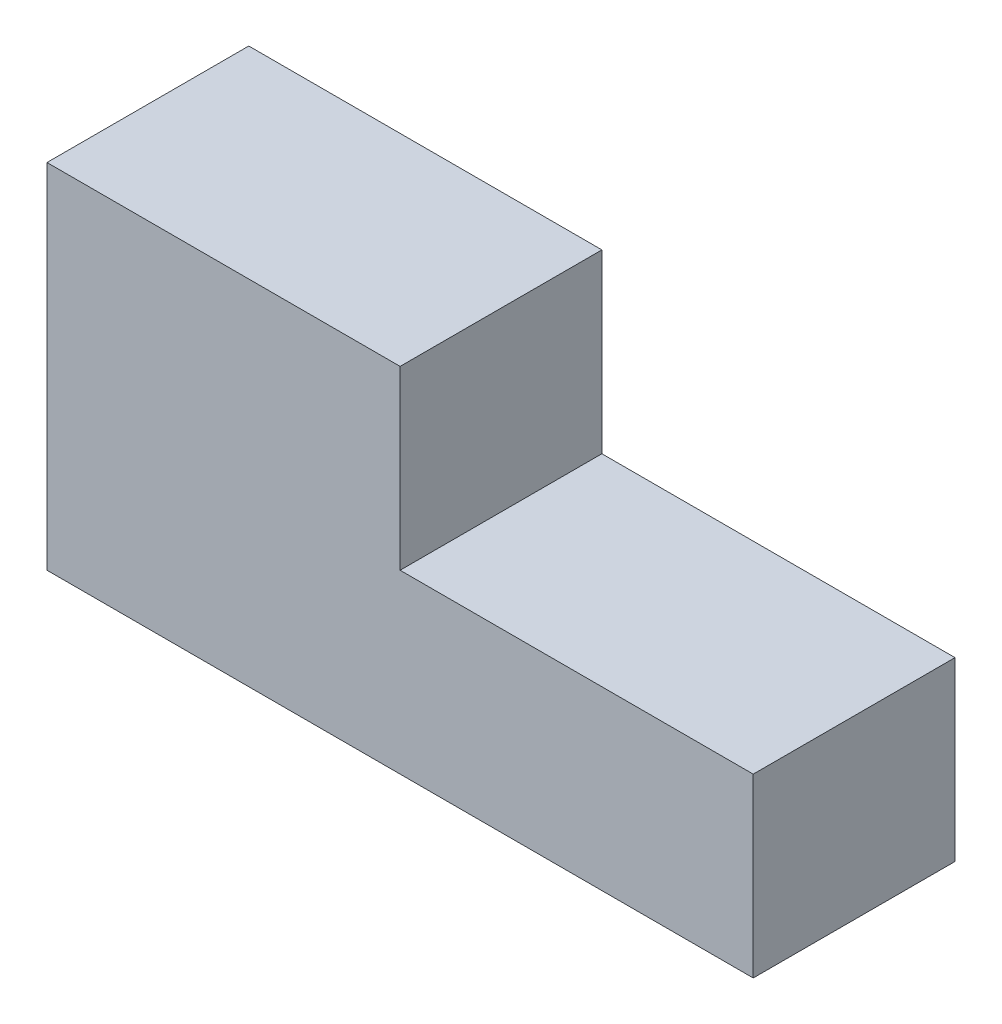
from build123d import *

# Parameters (mm, degrees)
BOSS_EXTRUDE1_DEPTH = 12.7


with BuildPart() as part:
    # Sketch2 → Boss-Extrude1 (new, symmetric)
    with BuildSketch(Plane.XY):
        Polygon((-45.993128667, 20.014327215), (-45.993128667, -24.435672785), (42.906871333, -24.435672785), (42.906871333, -2.210672785), (-1.543128667, -2.210672785), (-1.543128667, 20.014327215), align=None)
    extrude(amount=BOSS_EXTRUDE1_DEPTH, both=True)


solid = part.part
